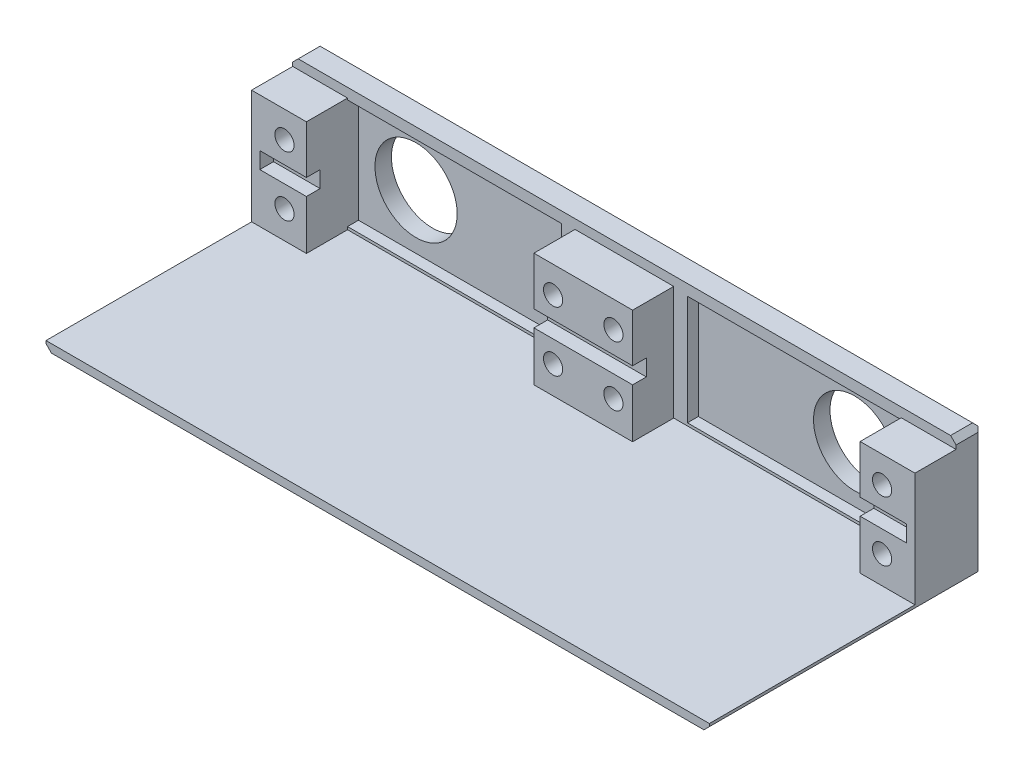
from build123d import *

# Parameters (mm, degrees)
SZKIC1_W                    = 121
SZKIC1_H                    = 24
SZKIC1_R                    = 7.5
DODANIE_WYCI_GNI_CIE1_DEPTH = 3
SZKIC2_W                    = 121
SZKIC2_H                    = 24
SZKIC2_W_2                  = 39
SZKIC2_H_2                  = 20
DODANIE_WYCI_GNI_CIE2_DEPTH = 2
SZKIC3_W                    = 10
SZKIC3_H                    = 21
SZKIC3_W_2                  = 18
DODANIE_WYCI_GNI_CIE3_DEPTH = 5
SZKIC5_W                    = 18
SZKIC5_H                    = 9
DODANIE_WYCI_GNI_CIE4_DEPTH = 2.5
WYTNIJ_WYCI_GNI_CIE1_REACH  = 103.983
SZKIC6_R                    = 1.75
WYTNIJ_WYCI_GNI_CIE2_START  = -1.5
SZKIC7_R                    = 3.75
SZKIC7_R_2                  = 1.75
WYTNIJ_WYCI_GNI_CIE2_DEPTH  = 1.5
WYTNIJ_WYCI_GNI_CIE4_DEPTH  = 1.5
ZAOKR_GLENIE1_R             = 1.5
SZKIC10_W                   = 10
SZKIC10_H                   = 7.5
SZKIC10_W_2                 = 18
WYTNIJ_WYCI_GNI_CIE5_DEPTH  = 0.2
SZKIC11_W                   = 121
SZKIC11_H                   = 1.5
DODANIE_WYCI_GNI_CIE5_DEPTH = 45
SFAZOWANIE1_SIZE            = 1
SFAZOWANIE2_SIZE            = 1


with BuildPart() as part:
    # Szkic1 → Dodanie-wyciągnięcie1 (new body)
    with BuildSketch(Plane.XY):
        with Locations((40, 0)):
            Rectangle(SZKIC1_W, SZKIC1_H)
        Circle(SZKIC1_R, mode=Mode.SUBTRACT)
        with Locations((80, 0)):
            Circle(SZKIC1_R, mode=Mode.SUBTRACT)
    extrude(amount=DODANIE_WYCI_GNI_CIE1_DEPTH)

    # Szkic2 → Dodanie-wyciągnięcie2 (add)
    with BuildSketch(Plane.XY.offset(3)):
        with Locations((40, 0)):
            Rectangle(SZKIC2_W, SZKIC2_H)
        with Locations((9, 0)):
            Rectangle(SZKIC2_W_2, SZKIC2_H_2, mode=Mode.SUBTRACT)
        with Locations((71, 0)):
            Rectangle(SZKIC2_W_2, SZKIC2_H_2, mode=Mode.SUBTRACT)
    extrude(amount=DODANIE_WYCI_GNI_CIE2_DEPTH)

    # Szkic3 → Dodanie-wyciągnięcie3 (add)
    with BuildSketch(Plane.XY.offset(5)):
        with Locations((-15.5, 0)):
            Rectangle(SZKIC3_W, SZKIC3_H)
        with Locations((40, 0)):
            Rectangle(SZKIC3_W_2, SZKIC3_H)
        with Locations((95.5, 0)):
            Rectangle(SZKIC3_W, SZKIC3_H)
    extrude(amount=DODANIE_WYCI_GNI_CIE3_DEPTH)

    # Szkic5 → Dodanie-wyciągnięcie4 (add)
    with BuildSketch(Plane.XY.offset(10)):
        Polygon((-20.5, 10.5), (-10.5, 10.5), (-10.5, 1.5), (-19, 1.5), (-19, -1.5), (-10.5, -1.5), (-10.5, -10.5), (-20.5, -10.5), align=None)
        Polygon((90.5, -1.5), (99, -1.5), (99, 1.5), (90.5, 1.5), (90.5, 10.5), (100.5, 10.5), (100.5, -10.5), (90.5, -10.5), align=None)
        with Locations((40, -6)):
            Rectangle(SZKIC5_W, SZKIC5_H)
        with Locations((40, 6)):
            Rectangle(SZKIC5_W, SZKIC5_H)
    extrude(amount=DODANIE_WYCI_GNI_CIE4_DEPTH)

    # Szkic6 → Wytnij-wyciągnięcie1 (cut, up to next)
    with BuildSketch(Plane.XY.offset(12.5), mode=Mode.PRIVATE) as wytnij_wyci_gni_cie1_sk1:
        with Locations((-14.5, 5.45)):
            Circle(SZKIC6_R)
    wytnij_wyci_gni_cie1_tool1 = extrude(wytnij_wyci_gni_cie1_sk1.sketch, amount=-WYTNIJ_WYCI_GNI_CIE1_REACH, mode=Mode.PRIVATE) & part.part
    # Szkic6 → Wytnij-wyciągnięcie1 (cut, up to next)
    with BuildSketch(Plane.XY.offset(12.5), mode=Mode.PRIVATE) as wytnij_wyci_gni_cie1_sk2:
        with Locations((34.5, 5.45)):
            Circle(SZKIC6_R)
    wytnij_wyci_gni_cie1_tool2 = extrude(wytnij_wyci_gni_cie1_sk2.sketch, amount=-WYTNIJ_WYCI_GNI_CIE1_REACH, mode=Mode.PRIVATE) & part.part
    # Szkic6 → Wytnij-wyciągnięcie1 (cut, up to next)
    with BuildSketch(Plane.XY.offset(12.5), mode=Mode.PRIVATE) as wytnij_wyci_gni_cie1_sk3:
        with Locations((34.5, -5.45)):
            Circle(SZKIC6_R)
    wytnij_wyci_gni_cie1_tool3 = extrude(wytnij_wyci_gni_cie1_sk3.sketch, amount=-WYTNIJ_WYCI_GNI_CIE1_REACH, mode=Mode.PRIVATE) & part.part
    # Szkic6 → Wytnij-wyciągnięcie1 (cut, up to next)
    with BuildSketch(Plane.XY.offset(12.5), mode=Mode.PRIVATE) as wytnij_wyci_gni_cie1_sk4:
        with Locations((-14.5, -5.45)):
            Circle(SZKIC6_R)
    wytnij_wyci_gni_cie1_tool4 = extrude(wytnij_wyci_gni_cie1_sk4.sketch, amount=-WYTNIJ_WYCI_GNI_CIE1_REACH, mode=Mode.PRIVATE) & part.part
    # Szkic6 → Wytnij-wyciągnięcie1 (cut, up to next)
    with BuildSketch(Plane.XY.offset(12.5), mode=Mode.PRIVATE) as wytnij_wyci_gni_cie1_sk5:
        with Locations((45.5, 5.45)):
            Circle(SZKIC6_R)
    wytnij_wyci_gni_cie1_tool5 = extrude(wytnij_wyci_gni_cie1_sk5.sketch, amount=-WYTNIJ_WYCI_GNI_CIE1_REACH, mode=Mode.PRIVATE) & part.part
    # Szkic6 → Wytnij-wyciągnięcie1 (cut, up to next)
    with BuildSketch(Plane.XY.offset(12.5), mode=Mode.PRIVATE) as wytnij_wyci_gni_cie1_sk6:
        with Locations((45.5, -5.45)):
            Circle(SZKIC6_R)
    wytnij_wyci_gni_cie1_tool6 = extrude(wytnij_wyci_gni_cie1_sk6.sketch, amount=-WYTNIJ_WYCI_GNI_CIE1_REACH, mode=Mode.PRIVATE) & part.part
    # Szkic6 → Wytnij-wyciągnięcie1 (cut, up to next)
    with BuildSketch(Plane.XY.offset(12.5), mode=Mode.PRIVATE) as wytnij_wyci_gni_cie1_sk7:
        with Locations((94.5, -5.45)):
            Circle(SZKIC6_R)
    wytnij_wyci_gni_cie1_tool7 = extrude(wytnij_wyci_gni_cie1_sk7.sketch, amount=-WYTNIJ_WYCI_GNI_CIE1_REACH, mode=Mode.PRIVATE) & part.part
    # Szkic6 → Wytnij-wyciągnięcie1 (cut, up to next)
    with BuildSketch(Plane.XY.offset(12.5), mode=Mode.PRIVATE) as wytnij_wyci_gni_cie1_sk8:
        with Locations((94.5, 5.45)):
            Circle(SZKIC6_R)
    wytnij_wyci_gni_cie1_tool8 = extrude(wytnij_wyci_gni_cie1_sk8.sketch, amount=-WYTNIJ_WYCI_GNI_CIE1_REACH, mode=Mode.PRIVATE) & part.part
    add(wytnij_wyci_gni_cie1_tool1.solids().sort_by_distance((-14.5, 5.45, 12.5))[0], mode=Mode.SUBTRACT)
    add(wytnij_wyci_gni_cie1_tool2.solids().sort_by_distance((34.5, 5.45, 12.5))[0], mode=Mode.SUBTRACT)
    add(wytnij_wyci_gni_cie1_tool3.solids().sort_by_distance((34.5, -5.45, 12.5))[0], mode=Mode.SUBTRACT)
    add(wytnij_wyci_gni_cie1_tool4.solids().sort_by_distance((-14.5, -5.45, 12.5))[0], mode=Mode.SUBTRACT)
    add(wytnij_wyci_gni_cie1_tool5.solids().sort_by_distance((45.5, 5.45, 12.5))[0], mode=Mode.SUBTRACT)
    add(wytnij_wyci_gni_cie1_tool6.solids().sort_by_distance((45.5, -5.45, 12.5))[0], mode=Mode.SUBTRACT)
    add(wytnij_wyci_gni_cie1_tool7.solids().sort_by_distance((94.5, -5.45, 12.5))[0], mode=Mode.SUBTRACT)
    add(wytnij_wyci_gni_cie1_tool8.solids().sort_by_distance((94.5, 5.45, 12.5))[0], mode=Mode.SUBTRACT)

    # Szkic7 → Wytnij-wyciągnięcie2 (cut)
    # profile 1 of 4: a face of its own
    with BuildSketch(Plane(origin=(0, 0, 0), x_dir=(-1, 0, 0), z_dir=(0, 0, -1)).offset(WYTNIJ_WYCI_GNI_CIE2_START)):
        with Locations((14.5, -5.45)):
            Circle(SZKIC7_R)
        with Locations(Location((14.5, -5.45, 0), (0, 0, 180))):
            Circle(SZKIC7_R_2, mode=Mode.SUBTRACT)
    # profile 2 of 4: a face of its own
    with BuildSketch(Plane(origin=(0, 0, 0), x_dir=(-1, 0, 0), z_dir=(0, 0, -1)).offset(WYTNIJ_WYCI_GNI_CIE2_START)):
        with Locations((14.5, 5.45)):
            Circle(SZKIC7_R)
        with Locations(Location((14.5, 5.45, 0), (0, 0, 180))):
            Circle(SZKIC7_R_2, mode=Mode.SUBTRACT)
    # profile 3 of 4: a face of its own
    with BuildSketch(Plane(origin=(0, 0, 0), x_dir=(-1, 0, 0), z_dir=(0, 0, -1)).offset(WYTNIJ_WYCI_GNI_CIE2_START)):
        with Locations((-94.5, -5.45)):
            Circle(SZKIC7_R)
        with Locations(Location((-94.5, -5.45, 0), (0, 0, 180))):
            Circle(SZKIC7_R_2, mode=Mode.SUBTRACT)
    # profile 4 of 4: a face of its own
    with BuildSketch(Plane(origin=(0, 0, 0), x_dir=(-1, 0, 0), z_dir=(0, 0, -1)).offset(WYTNIJ_WYCI_GNI_CIE2_START)):
        with Locations((-94.5, 5.45)):
            Circle(SZKIC7_R)
        with Locations(Location((-94.5, 5.45, 0), (0, 0, 180))):
            Circle(SZKIC7_R_2, mode=Mode.SUBTRACT)
    extrude(amount=WYTNIJ_WYCI_GNI_CIE2_DEPTH, mode=Mode.SUBTRACT)

    # Szkic9 → Wytnij-wyciągnięcie4 (cut)
    with BuildSketch(Plane(origin=(0, 0, 0), x_dir=(-1, 0, 0), z_dir=(0, 0, -1))):
        with BuildLine():
            Line((-40.883453672, 7.95), (-39.116546328, 7.95))
            ThreePointArc((-39.116546328, 7.95), (-29.25, 5.45), (-39.116546328, 2.95))
            Line((-39.116546328, 2.95), (-40.883453672, 2.95))
            ThreePointArc((-40.883453672, 2.95), (-50.75, 5.45), (-40.883453672, 7.95))
        make_face()
        with BuildLine():
            Line((-40.883453672, -7.95), (-39.116546328, -7.95))
            ThreePointArc((-39.116546328, -7.95), (-29.25, -5.45), (-39.116546328, -2.95))
            Line((-39.116546328, -2.95), (-40.883453672, -2.95))
            ThreePointArc((-40.883453672, -2.95), (-50.75, -5.45), (-40.883453672, -7.95))
        make_face()
    extrude(amount=-WYTNIJ_WYCI_GNI_CIE4_DEPTH, mode=Mode.SUBTRACT)

    # Zaokrąglenie1
    zaokr_glenie1_edges = [part.edges().sort_by_distance(p)[0] for p in [
        (39.116546328, -7.95, 0.75),
        (39.116546328, -2.95, 0.75),
        (40.883453672, -2.95, 0.75),
        (40.883453672, -7.95, 0.75),
        (39.116546328, 2.95, 0.75),
        (39.116546328, 7.95, 0.75),
        (40.883453672, 7.95, 0.75),
        (40.883453672, 2.95, 0.75),
    ]]
    fillet(zaokr_glenie1_edges, radius=ZAOKR_GLENIE1_R)

    # Szkic10 → Wytnij-wyciągnięcie5 (cut)
    with BuildSketch(Plane(origin=(0, 10.5, 0), x_dir=(1, 0, 0), z_dir=(0, 1, 0))):
        with Locations((-15.5, -8.75)):
            Rectangle(SZKIC10_W, SZKIC10_H)
        with Locations((40, -8.75)):
            Rectangle(SZKIC10_W_2, SZKIC10_H)
        with Locations((95.5, -8.75)):
            Rectangle(SZKIC10_W, SZKIC10_H)
    extrude(amount=-WYTNIJ_WYCI_GNI_CIE5_DEPTH, mode=Mode.SUBTRACT)

    # Szkic11 → Dodanie-wyciągnięcie5 (add)
    with BuildSketch(Plane.XY.offset(5)):
        with Locations((40, -11.25)):
            Rectangle(SZKIC11_W, SZKIC11_H)
    extrude(amount=DODANIE_WYCI_GNI_CIE5_DEPTH)

    # Sfazowanie1
    sfazowanie1_edges = [part.edges().sort_by_distance(p)[0] for p in [
        (40, -12, 0),
        (-20.5, 0, 0),
        (40, 12, 0),
        (100.5, 0, 0),
    ]]
    chamfer(sfazowanie1_edges, length=SFAZOWANIE1_SIZE)

    # Sfazowanie2
    sfazowanie2_edges = [part.edges().sort_by_distance(p)[0] for p in [
        (100.5, -12, 25.5),
        (-20.5, -12, 25.5),
        (-20.5, 12, 3),
        (100.5, 12, 3),
    ]]
    chamfer(sfazowanie2_edges, length=SFAZOWANIE2_SIZE)


solid = part.part
